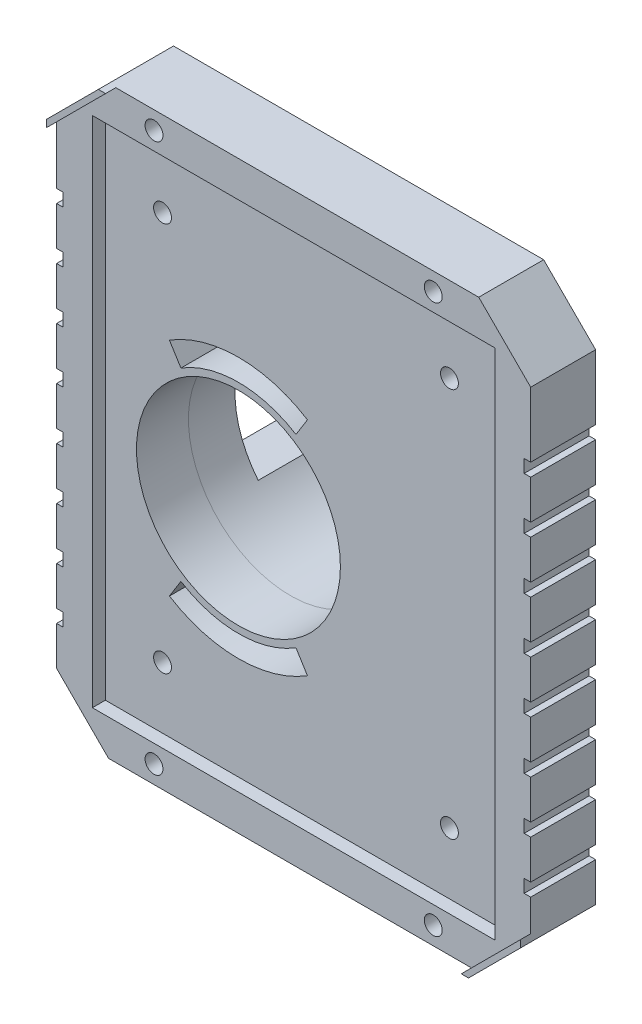
from build123d import *

# Parameters (mm, degrees)
SKETCH1_W           = 92.71
SKETCH1_H           = 114.3
BOSS_EXTRUDE1_DEPTH = 12.7
SKETCH2_W           = 78.71000006
SKETCH2_H           = 100.30000006
CUT_EXTRUDE1_DEPTH  = 2.54
SKETCH3_R           = 19.939
CUT_EXTRUDE2_DEPTH  = 75.284144506
SKETCH4_R           = 26.9875
SKETCH4_R_2         = 19.98750003
BOSS_EXTRUDE2_DEPTH = 21.844
SKETCH6_R           = 1.750000056
CUT_EXTRUDE3_DEPTH  = 19.05
SKETCH12_W          = 12.7
SKETCH12_H          = 25.4
CUT_EXTRUDE6_DEPTH  = 77.759812799
SKETCH13_W          = 11.43
SKETCH13_H          = 11.43
CUT_EXTRUDE7_DEPTH  = 77.759812799
SKETCH14_R          = 1.750000056
CUT_EXTRUDE8_DEPTH  = 82.290814124
SKETCH16_W          = 8.89
SKETCH16_H          = 5.08
CUT_EXTRUDE9_DEPTH  = 3.81
SKETCH18_R          = 1.75
CUT_EXTRUDE11_DEPTH = 5.08
SKETCH19_W          = 2.54
SKETCH19_H          = 2.54
CUT_EXTRUDE12_DEPTH = 82.290814124
CHAMFER2_SIZE       = 10.16
CUT_EXTRUDE13_DEPTH = 82.290814124
BOSS_EXTRUDE3_DEPTH = 2
CUT_EXTRUDE14_START = -7.62
CUT_EXTRUDE14_DEPTH = 7.62


with BuildPart() as part:
    # Sketch1 → Boss-Extrude1 (new body)
    with BuildSketch(Plane.XY):
        Rectangle(SKETCH1_W, SKETCH1_H)
    extrude(amount=BOSS_EXTRUDE1_DEPTH)

    # Sketch2 → Cut-Extrude1 (cut)
    with BuildSketch(Plane.XY.offset(12.7)):
        Rectangle(SKETCH2_W, SKETCH2_H)
    extrude(amount=-CUT_EXTRUDE1_DEPTH, mode=Mode.SUBTRACT)

    # Sketch3 → Cut-Extrude2 (cut, through all)
    with BuildSketch(Plane.XY.offset(10.16)):
        with Locations((-13.335, -4.572)):
            Circle(SKETCH3_R)
    extrude(amount=-CUT_EXTRUDE2_DEPTH, mode=Mode.SUBTRACT)

    # Sketch4 → Boss-Extrude2 (add)
    with BuildSketch(Plane(origin=(0, 0, 0), x_dir=(-1, 0, 0), z_dir=(0, 0, -1))):
        with Locations((13.335, -4.572)):
            Circle(SKETCH4_R)
        with Locations((13.335, -4.572)):
            Circle(SKETCH4_R_2, mode=Mode.SUBTRACT)
    extrude(amount=BOSS_EXTRUDE2_DEPTH)

    # Sketch6 → Cut-Extrude3 (cut)
    with BuildSketch(Plane(origin=(0, 0, -21.844), x_dir=(-1, 0, 0), z_dir=(0, 0, -1))):
        with Locations((-2.11782644, 12.446)):
            Circle(SKETCH6_R)
        with Locations((28.78782644, -21.59)):
            Circle(SKETCH6_R)
        with Locations((28.78782644, 12.446)):
            Circle(SKETCH6_R)
        with Locations((-2.11782644, -21.59)):
            Circle(SKETCH6_R)
    extrude(amount=-CUT_EXTRUDE3_DEPTH, mode=Mode.SUBTRACT)

    # Sketch12 → Cut-Extrude6 (cut, through all)
    with BuildSketch(Plane(origin=(0, 0, 0), x_dir=(0, 0, -1), z_dir=(1, 0, 0))):
        with Locations((15.494, -4.572)):
            Rectangle(SKETCH12_W, SKETCH12_H)
    extrude(amount=-CUT_EXTRUDE6_DEPTH, mode=Mode.SUBTRACT)

    # Sketch13 → Cut-Extrude7 (cut, through all)
    with BuildSketch(Plane(origin=(0, 0, 0), x_dir=(0, 0, -1), z_dir=(1, 0, 0))):
        with Locations((16.129, 0.508)):
            Rectangle(SKETCH13_W, SKETCH13_H)
    extrude(amount=CUT_EXTRUDE7_DEPTH, mode=Mode.SUBTRACT)

    # Sketch14 → Cut-Extrude8 (cut, through all)
    with BuildSketch(Plane.XY.offset(12.7)):
        with Locations((-27.305, 53.65)):
            Circle(SKETCH14_R)
        with Locations((27.305, 53.65)):
            Circle(SKETCH14_R)
        with Locations((-27.305, -53.65)):
            Circle(SKETCH14_R)
        with Locations((27.305, -53.65)):
            Circle(SKETCH14_R)
    extrude(amount=-CUT_EXTRUDE8_DEPTH, mode=Mode.SUBTRACT)

    # Sketch16 → Cut-Extrude9 (cut)
    with BuildSketch(Plane(origin=(0, 0, 0), x_dir=(-1, 0, 0), z_dir=(0, 0, -1))):
        with Locations((-27.305, 53.65)):
            Rectangle(SKETCH16_W, SKETCH16_H)
        with Locations((27.305, 53.65)):
            Rectangle(SKETCH16_W, SKETCH16_H)
        with Locations((27.305, -53.65)):
            Rectangle(SKETCH16_W, SKETCH16_H)
        with Locations((-27.305, -53.65)):
            Rectangle(SKETCH16_W, SKETCH16_H)
    extrude(amount=-CUT_EXTRUDE9_DEPTH, mode=Mode.SUBTRACT)

    # Sketch18 → Cut-Extrude11 (cut)
    with BuildSketch(Plane.XY.offset(10.16)):
        with Locations((-28.17900003, 38.02150003)):
            Circle(SKETCH18_R)
        with Locations((27.92500003, 38.02150003)):
            Circle(SKETCH18_R)
        with Locations((-28.17900003, -38.14850003)):
            Circle(SKETCH18_R)
        with Locations((27.92500003, -38.14850003)):
            Circle(SKETCH18_R)
    extrude(amount=-CUT_EXTRUDE11_DEPTH, mode=Mode.SUBTRACT)

    # Sketch19 → Cut-Extrude12 (cut, through all)
    with BuildSketch(Plane.XY.offset(12.7)):
        with Locations((-46.355, -38.1)):
            Rectangle(SKETCH19_W, SKETCH19_H)
        with Locations((46.355, -38.1)):
            Rectangle(SKETCH19_W, SKETCH19_H)
        with Locations((-46.355, -27.94)):
            Rectangle(SKETCH19_W, SKETCH19_H)
        with Locations((46.355, -27.94)):
            Rectangle(SKETCH19_W, SKETCH19_H)
        with Locations((-46.355, -17.78)):
            Rectangle(SKETCH19_W, SKETCH19_H)
        with Locations((46.355, -17.78)):
            Rectangle(SKETCH19_W, SKETCH19_H)
        with Locations((-46.355, -7.62)):
            Rectangle(SKETCH19_W, SKETCH19_H)
        with Locations((46.355, -7.62)):
            Rectangle(SKETCH19_W, SKETCH19_H)
        with Locations((-46.355, 2.54)):
            Rectangle(SKETCH19_W, SKETCH19_H)
        with Locations((46.355, 2.54)):
            Rectangle(SKETCH19_W, SKETCH19_H)
        with Locations((-46.355, 12.7)):
            Rectangle(SKETCH19_W, SKETCH19_H)
        with Locations((46.355, 12.7)):
            Rectangle(SKETCH19_W, SKETCH19_H)
        with Locations((-46.355, 22.86)):
            Rectangle(SKETCH19_W, SKETCH19_H)
        with Locations((46.355, 22.86)):
            Rectangle(SKETCH19_W, SKETCH19_H)
        with Locations((-46.355, 33.02)):
            Rectangle(SKETCH19_W, SKETCH19_H)
        with Locations((46.355, 33.02)):
            Rectangle(SKETCH19_W, SKETCH19_H)
    extrude(amount=-CUT_EXTRUDE12_DEPTH, mode=Mode.SUBTRACT)

    # Chamfer2
    chamfer2_edges = [part.edges().sort_by_distance(p)[0] for p in [
        (46.355, -57.15, 6.35),
        (-46.355, -57.15, 6.35),
        (-46.355, 57.15, 6.35),
        (46.355, 57.15, 6.35),
    ]]
    chamfer(chamfer2_edges, length=CHAMFER2_SIZE)

    # Sketch20 → Cut-Extrude13 (cut, through all)
    with BuildSketch(Plane(origin=(0, 0, -21.844), x_dir=(-1, 0, 0), z_dir=(0, 0, -1))):
        with BuildLine():
            Line((-0.161794567, 17.099636308), (2.084843313, 13.492237618))
            ThreePointArc((2.084843313, 13.492237618), (13.335, 16.709041004), (24.585156687, 13.492237618))
            Line((24.585156687, 13.492237618), (26.831794567, 17.099636308))
            ThreePointArc((26.831794567, 17.099636308), (13.335, 20.958830066), (-0.161794567, 17.099636308))
        make_face()
        with BuildLine():
            Line((2.084843313, -22.636237618), (-0.161794567, -26.243636308))
            ThreePointArc((-0.161794567, -26.243636308), (13.335, -30.102830066), (26.831794567, -26.243636308))
            Line((26.831794567, -26.243636308), (24.585156687, -22.636237618))
            ThreePointArc((24.585156687, -22.636237618), (13.335, -25.853041004), (2.084843313, -22.636237618))
        make_face()
    extrude(amount=-CUT_EXTRUDE13_DEPTH, mode=Mode.SUBTRACT)

    # Sketch21 → Boss-Extrude3 (add)
    with BuildSketch(Plane.XY.offset(12.7)):
        Polygon((-40.567893219, 51.362893219), (-46.355, 45.575786438), (-46.355, 46.99), (-36.195, 57.15), (-34.780786438, 57.15), align=None)
        Polygon((40.567893219, -51.362893219), (34.780786438, -57.15), (36.195, -57.15), (46.355, -46.99), (46.355, -45.575786438), align=None)
    extrude(amount=BOSS_EXTRUDE3_DEPTH)

    # Sketch22 → Cut-Extrude14 (cut)
    with BuildSketch(Plane(origin=(0, 0, -21.844), x_dir=(-1, 0, 0), z_dir=(0, 0, -1)).offset(CUT_EXTRUDE14_START)):
        with BuildLine():
            Line((31.787826536, 8.128), (31.787826536, 13.716))
            Line((31.787826536, 13.716), (33.181264441, 13.716))
            ThreePointArc((33.181264441, 13.716), (35.342461556, 11.04839667), (37.1475, 8.128))
            Line((37.1475, 8.128), (31.787826536, 8.128))
        make_face()
    extrude(amount=CUT_EXTRUDE14_DEPTH, mode=Mode.SUBTRACT)


solid = part.part
